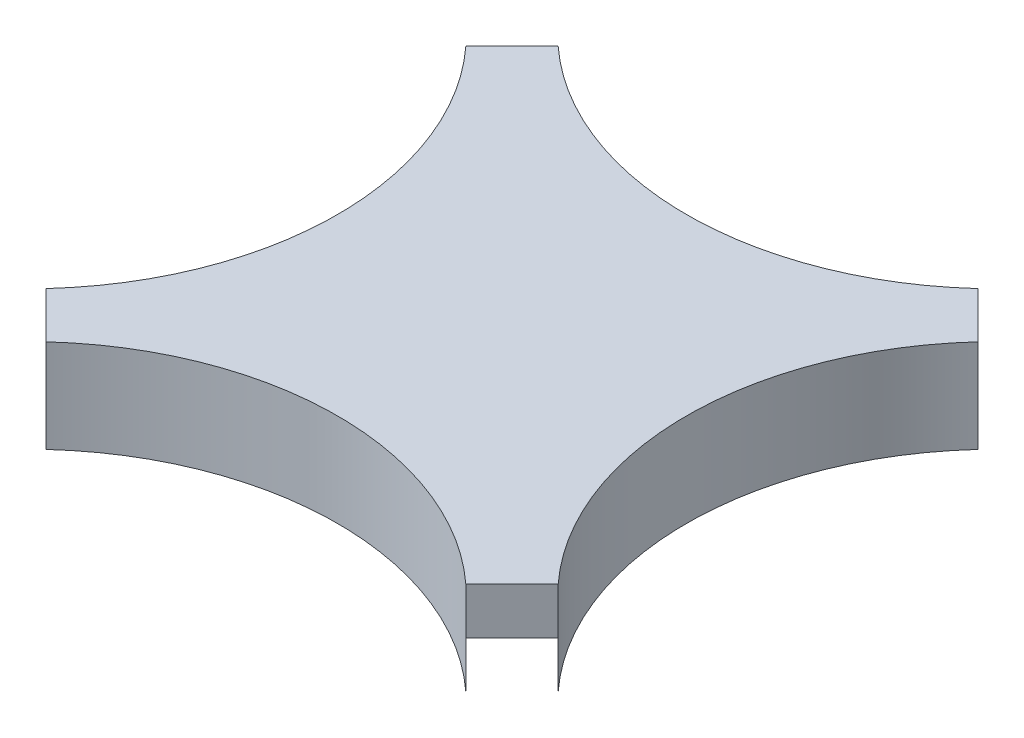
from build123d import *

# Parameters (mm, degrees)
BOSS_EXTRUDE1_DEPTH        = 1.5
BOSS_EXTRUDE1_DEPTH_BACK   = 1.5
BOSS_EXTRUDE1_2_DEPTH      = 1.5
BOSS_EXTRUDE1_2_DEPTH_BACK = 1.5
BOSS_EXTRUDE1_3_DEPTH      = 1.5
BOSS_EXTRUDE1_3_DEPTH_BACK = 1.5
BOSS_EXTRUDE1_4_DEPTH      = 1.5
BOSS_EXTRUDE1_4_DEPTH_BACK = 1.5
BOSS_EXTRUDE2_DEPTH        = 1.5


with BuildPart() as part:
    # Sketch1 → Boss-Extrude1 (new, two sides: drawn at the far end of the back side and taken through both)
    with BuildSketch(Plane(origin=(0, 0, 0), x_dir=(1, 0, 0), z_dir=(0, 1, 0)).offset(-BOSS_EXTRUDE1_DEPTH_BACK)):
        with BuildLine():
            Line((-3.764359918, 2.279435677), (-8.24246212, 6.75753788))
            ThreePointArc((-8.24246212, 6.75753788), (-5.613736217, 0), (-8.24246212, -6.75753788))
            Line((-8.24246212, -6.75753788), (-3.764359918, -2.279435677))
            ThreePointArc((-3.764359918, -2.279435677), (-2.935880264, 0), (-3.764359918, 2.279435677))
        make_face()
    extrude(amount=BOSS_EXTRUDE1_DEPTH + BOSS_EXTRUDE1_DEPTH_BACK)



with BuildPart() as body_2:
    # Sketch1 → Boss-Extrude1 2 (new, two sides: drawn at the far end of the back side and taken through both)
    with BuildSketch(Plane(origin=(0, 0, 0), x_dir=(1, 0, 0), z_dir=(0, 1, 0)).offset(-BOSS_EXTRUDE1_2_DEPTH_BACK)):
        with BuildLine():
            ThreePointArc((6.75753788, 8.24246212), (0, 5.613736217), (-6.75753788, 8.24246212))
            Line((-6.75753788, 8.24246212), (-2.279435677, 3.764359918))
            ThreePointArc((-2.279435677, 3.764359918), (0, 2.935880264), (2.279435677, 3.764359918))
            Line((2.279435677, 3.764359918), (6.75753788, 8.24246212))
        make_face()
    extrude(amount=BOSS_EXTRUDE1_2_DEPTH + BOSS_EXTRUDE1_2_DEPTH_BACK)


with BuildPart() as body_3:
    # Sketch1 → Boss-Extrude1 3 (new, two sides: drawn at the far end of the back side and taken through both)
    with BuildSketch(Plane(origin=(0, 0, 0), x_dir=(1, 0, 0), z_dir=(0, 1, 0)).offset(-BOSS_EXTRUDE1_3_DEPTH_BACK)):
        with BuildLine():
            Line((-2.279435677, -3.764359918), (-6.75753788, -8.24246212))
            ThreePointArc((-6.75753788, -8.24246212), (0, -5.613736217), (6.75753788, -8.24246212))
            Line((6.75753788, -8.24246212), (2.279435677, -3.764359918))
            ThreePointArc((2.279435677, -3.764359918), (0, -2.935880264), (-2.279435677, -3.764359918))
        make_face()
    extrude(amount=BOSS_EXTRUDE1_3_DEPTH + BOSS_EXTRUDE1_3_DEPTH_BACK)


with BuildPart() as body_4:
    # Sketch1 → Boss-Extrude1 4 (new, two sides: drawn at the far end of the back side and taken through both)
    with BuildSketch(Plane(origin=(0, 0, 0), x_dir=(1, 0, 0), z_dir=(0, 1, 0)).offset(-BOSS_EXTRUDE1_4_DEPTH_BACK)):
        with BuildLine():
            ThreePointArc((8.24246212, -6.75753788), (5.613736217, 0), (8.24246212, 6.75753788))
            Line((8.24246212, 6.75753788), (3.764359918, 2.279435677))
            ThreePointArc((3.764359918, 2.279435677), (2.935880264, 0), (3.764359918, -2.279435677))
            Line((3.764359918, -2.279435677), (8.24246212, -6.75753788))
        make_face()
    extrude(amount=BOSS_EXTRUDE1_4_DEPTH + BOSS_EXTRUDE1_4_DEPTH_BACK)


with BuildPart() as part_1:
    add(part.part)

    add(body_2.part)  # Boss-Extrude2 merges body 2

    add(body_3.part)  # Boss-Extrude2 merges body 3

    add(body_4.part)  # Boss-Extrude2 merges body 4
    # Sketch1<4> → Boss-Extrude2 (add)
    with BuildSketch(Plane(origin=(0, 0, 0), x_dir=(1, 0, 0), z_dir=(0, 1, 0))):
        with BuildLine():
            Line((-6.75753788, 8.24246212), (-8.24246212, 6.75753788))
            Line((-8.24246212, 6.75753788), (-3.764359918, 2.279435677))
            ThreePointArc((-3.764359918, 2.279435677), (-2.935880264, 0), (-3.764359918, -2.279435677))
            Line((-3.764359918, -2.279435677), (-8.24246212, -6.75753788))
            Line((-8.24246212, -6.75753788), (-6.75753788, -8.24246212))
            Line((-6.75753788, -8.24246212), (-2.279435677, -3.764359918))
            ThreePointArc((-2.279435677, -3.764359918), (0, -2.935880264), (2.279435677, -3.764359918))
            Line((2.279435677, -3.764359918), (6.75753788, -8.24246212))
            Line((6.75753788, -8.24246212), (8.24246212, -6.75753788))
            Line((8.24246212, -6.75753788), (3.764359918, -2.279435677))
            ThreePointArc((3.764359918, -2.279435677), (2.935880264, 0), (3.764359918, 2.279435677))
            Line((3.764359918, 2.279435677), (8.24246212, 6.75753788))
            Line((8.24246212, 6.75753788), (6.75753788, 8.24246212))
            Line((6.75753788, 8.24246212), (2.279435677, 3.764359918))
            ThreePointArc((2.279435677, 3.764359918), (0, 2.935880264), (-2.279435677, 3.764359918))
            Line((-2.279435677, 3.764359918), (-6.75753788, 8.24246212))
        make_face()
    extrude(amount=BOSS_EXTRUDE2_DEPTH)


solid = part_1.part
